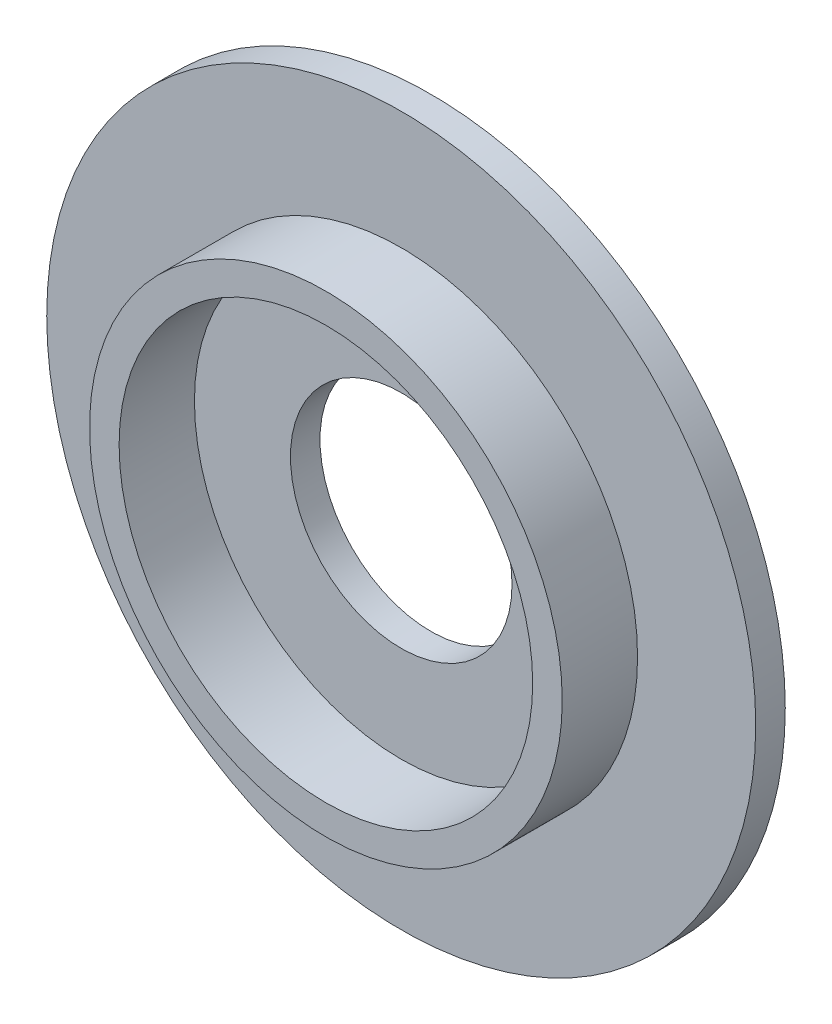
from build123d import *

# Parameters (mm, degrees)
SKETCH_1_R      = 120
SKETCH_1_R_2    = 37.5
EXTRUDE_1_DEPTH = 10
SKETCH_2_R      = 80
SKETCH_2_R_2    = 70
EXTRUDE_2_DEPTH = 25.5


with BuildPart() as part:
    # 草图1 → 拉伸1 (new body)
    with BuildSketch(Plane.XY):
        Circle(SKETCH_1_R)
        Circle(SKETCH_1_R_2, mode=Mode.SUBTRACT)
    extrude(amount=EXTRUDE_1_DEPTH)

    # 草图2 → 拉伸2 (add)
    with BuildSketch(Plane.XY.offset(10)):
        Circle(SKETCH_2_R)
        Circle(SKETCH_2_R_2, mode=Mode.SUBTRACT)
    extrude(amount=EXTRUDE_2_DEPTH)


solid = part.part
